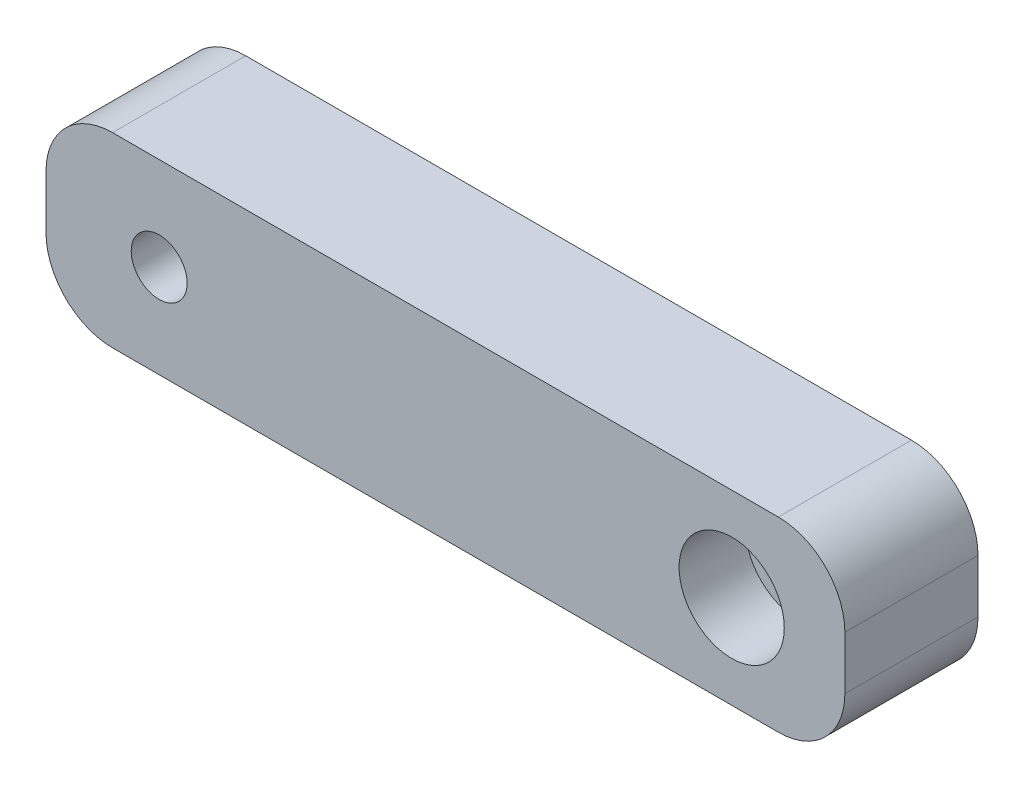
from build123d import *

# Parameters (mm, degrees)
SKETCH1_W           = 60
SKETCH1_H           = 14
BOSS_EXTRUDE1_DEPTH = 10
FILLET1_R           = 5
FILLET2_R           = 5
SKETCH2_R           = 4
CUT_EXTRUDE2_DEPTH  = 2.5
SKETCH3_R           = 2.1
CUT_EXTRUDE3_DEPTH  = 2
SKETCH4_R           = 3.95
CUT_EXTRUDE4_DEPTH  = 5
CUT_EXTRUDE5_REACH  = 64.926
SKETCH5_R           = 2
SKETCH7_R           = 2.1
CUT_EXTRUDE6_DEPTH  = 63.967570185
SKETCH6_R           = 4.1
CUT_EXTRUDE7_DEPTH  = 0.5


with BuildPart() as part:
    # Sketch1 → Boss-Extrude1 (new body)
    with BuildSketch(Plane.XY):
        with Locations((-29.350618243, 13.301945946)):
            Rectangle(SKETCH1_W, SKETCH1_H)
    extrude(amount=BOSS_EXTRUDE1_DEPTH)

    # Fillet1
    fillet1_edges = [part.edges().sort_by_distance(p)[0] for p in [
        (-59.350618243, 20.301945946, 5),
    ]]
    fillet(fillet1_edges, radius=FILLET1_R)

    # Fillet2
    fillet2_edges = [part.edges().sort_by_distance(p)[0] for p in [
        (0.649381757, 20.301945946, 5),
        (0.649381757, 6.301945946, 5),
        (-59.350618243, 6.301945946, 5),
    ]]
    fillet(fillet2_edges, radius=FILLET2_R)

    # Sketch2 → Cut-Extrude2 (cut)
    with BuildSketch(Plane(origin=(0, 0, 0), x_dir=(-1, 0, 0), z_dir=(0, 0, -1))):
        with Locations((50.850618243, 13.301945946)):
            Circle(SKETCH2_R)
    extrude(amount=-CUT_EXTRUDE2_DEPTH, mode=Mode.SUBTRACT)

    # Sketch3 → Cut-Extrude3 (cut)
    with BuildSketch(Plane(origin=(0, 0, 2.5), x_dir=(-1, 0, 0), z_dir=(0, 0, -1))):
        with Locations((50.850618243, 13.301945946)):
            Circle(SKETCH3_R)
    extrude(amount=-CUT_EXTRUDE3_DEPTH, mode=Mode.SUBTRACT)

    # Sketch4 → Cut-Extrude4 (cut)
    with BuildSketch(Plane.XY.offset(10)):
        with Locations((-7.850618243, 13.301945946)):
            Circle(SKETCH4_R)
    extrude(amount=-CUT_EXTRUDE4_DEPTH, mode=Mode.SUBTRACT)

    # Sketch5 → Cut-Extrude5 (cut, up to next)
    with BuildSketch(Plane.XY.offset(5), mode=Mode.PRIVATE) as cut_extrude5_sk1:
        with Locations((-7.850618243, 13.301945946)):
            Circle(SKETCH5_R)
    cut_extrude5_tool1 = extrude(cut_extrude5_sk1.sketch, amount=-CUT_EXTRUDE5_REACH, mode=Mode.PRIVATE) & part.part
    add(cut_extrude5_tool1.solids().sort_by_distance((-7.850618, 13.301946, 5))[0], mode=Mode.SUBTRACT)

    # Sketch7 → Cut-Extrude6 (cut, through all)
    with BuildSketch(Plane(origin=(0, 0, 4.5), x_dir=(-1, 0, 0), z_dir=(0, 0, -1))):
        with Locations((50.850618243, 13.301945946)):
            Circle(SKETCH7_R)
    extrude(amount=-CUT_EXTRUDE6_DEPTH, mode=Mode.SUBTRACT)

    # Sketch6 → Cut-Extrude7 (cut)
    with BuildSketch(Plane(origin=(0, 0, 0), x_dir=(-1, 0, 0), z_dir=(0, 0, -1))):
        with Locations((7.850618243, 13.301945946)):
            Circle(SKETCH6_R)
    extrude(amount=-CUT_EXTRUDE7_DEPTH, mode=Mode.SUBTRACT)


solid = part.part
